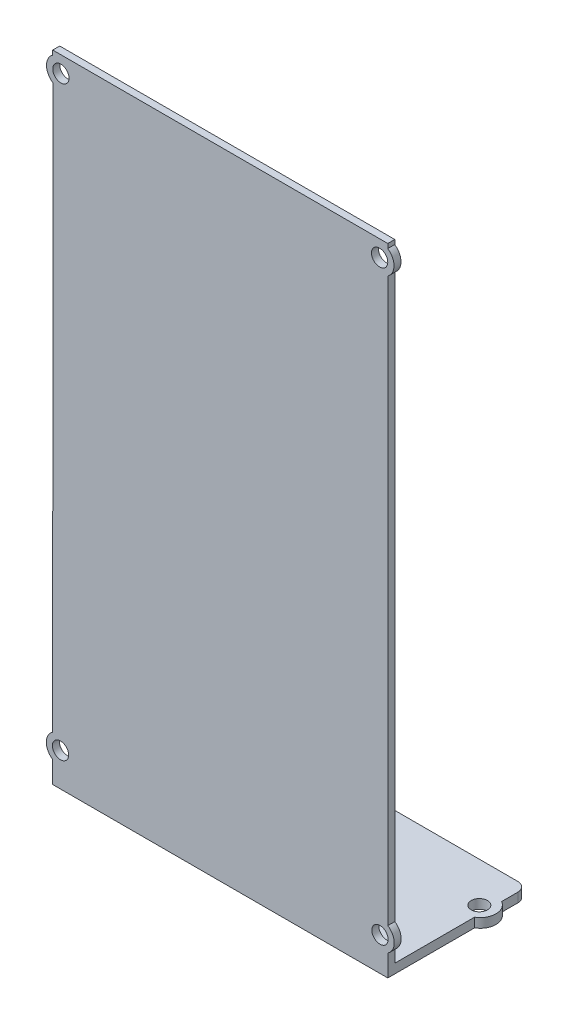
from build123d import *

# Parameters (mm, degrees)
SKETCH1_R                = 1.75
BOSS_EXTRUDE1_DEPTH      = 1.5
BOSS_EXTRUDE2_DEPTH      = 72
BOSS_EXTRUDE3_DEPTH      = 1.5
BOSS_EXTRUDE3_DEPTH_BACK = 1.5
BOSS_EXTRUDE4_DEPTH      = 2
SKETCH5_R                = 1.75
CUT_EXTRUDE1_DEPTH       = 2
CUT_EXTRUDE2_DEPTH       = 148.332054879
CUT_EXTRUDE2_DEPTH_BACK  = 148.332054879
SKETCH6_W                = 72
SKETCH6_H                = 11.553195909
FILLET1_R                = 2
SKETCH8_W                = 35
SKETCH8_H                = 19.946804091
CUT_EXTRUDE3_DEPTH       = 22.4262221


with BuildPart() as part:
    # Sketch1 → Boss-Extrude1 (new body)
    with BuildSketch(Plane.XY):
        with BuildLine():
            Line((-31.5, -134.5), (31.5, -134.5))
            Line((31.5, -134.5), (36, -134.5))
            Line((36, -134.5), (36, -132.049019419))
            ThreePointArc((36, -132.049019419), (37.374296294, -129.5), (36, -126.950980581))
            Line((36, -126.950980581), (36, -6.049019419))
            ThreePointArc((36, -6.049019419), (37.33874188, -3.5), (36, -0.950980581))
            Line((36, -0.950980581), (36, 0))
            Line((36, 0), (-36, 0))
            Line((-36, 0), (-36, -0.950980581))
            ThreePointArc((-36, -0.950980581), (-37.339851511, -3.504206195), (-35.994020506, -6.054285021))
            Line((-35.994020506, -6.054285021), (-36, -126.950980581))
            ThreePointArc((-36, -126.950980581), (-37.376731289, -129.5), (-36, -132.049019419))
            Line((-36, -132.049019419), (-36, -134.5))
            Line((-36, -134.5), (-31.5, -134.5))
        make_face()
        with Locations((-34.328609587, -129.5)):
            Circle(SKETCH1_R, mode=Mode.SUBTRACT)
        with Locations((34.323211043, -129.5)):
            Circle(SKETCH1_R, mode=Mode.SUBTRACT)
        with Locations((34.242652207, -3.5)):
            Circle(SKETCH1_R, mode=Mode.SUBTRACT)
        with Locations((-34.244120111, -3.500578956)):
            Circle(SKETCH1_R, mode=Mode.SUBTRACT)
    extrude(amount=BOSS_EXTRUDE1_DEPTH)

    # Sketch2 → Boss-Extrude2 (add)
    with BuildSketch(Plane.ZY.offset(36)):
        Polygon((1.5, -134.5), (1.5, -136.7), (-40, -136.7), (-40, -134.7), (0, -134.7), (0, -134.5), (0, -132.049019419), (1.5, -132.049019419), align=None)
    extrude(amount=-BOSS_EXTRUDE2_DEPTH)

    # Sketch3 → Boss-Extrude3 (add, two sides: drawn at the far end of the back side and taken through both)
    with BuildSketch(Plane(origin=(0, 0, 0), x_dir=(0, 0, -1), z_dir=(1, 0, 0)).offset(-BOSS_EXTRUDE3_DEPTH_BACK)):
        Polygon((0, -119.7), (15, -134.7), (0, -134.7), align=None)
    extrude(amount=BOSS_EXTRUDE3_DEPTH + BOSS_EXTRUDE3_DEPTH_BACK)

    # Sketch4 → Boss-Extrude4 (add)
    with BuildSketch(Plane.XZ.offset(136.7)):
        with BuildLine():
            Line((-36, -17.152805247), (-36, -22.963011674))
            ThreePointArc((-36, -22.963011674), (-37.650416645, -20.05790846), (-36, -17.152805247))
        make_face()
        with BuildLine():
            Line((36, -17.152805247), (36, -22.963011674))
            ThreePointArc((36, -22.963011674), (37.68082264, -20.05790846), (36, -17.152805247))
        make_face()
    extrude(amount=-BOSS_EXTRUDE4_DEPTH)

    # Sketch5 → Cut-Extrude1 (cut)
    with BuildSketch(Plane.XZ.offset(136.7)):
        with Locations(Location((-34.253947115, -19.946804091, 0), (0, 0, 270))):
            Circle(SKETCH5_R)
        with Locations(Location((34.288977705, -19.889159472, 0), (0, 0, 270))):
            Circle(SKETCH5_R)
    extrude(amount=-CUT_EXTRUDE1_DEPTH, mode=Mode.SUBTRACT)

    # Sketch6 → Cut-Extrude2 (cut, two sides: drawn at the far end of the back side and taken through both)
    with BuildSketch(Plane.XZ.offset(136.7).offset(-CUT_EXTRUDE2_DEPTH_BACK)):
        with Locations((0, -34.223402046)):
            Rectangle(SKETCH6_W, SKETCH6_H)
    extrude(amount=CUT_EXTRUDE2_DEPTH + CUT_EXTRUDE2_DEPTH_BACK, mode=Mode.SUBTRACT)

    # Fillet1
    fillet1_edges = [part.edges().sort_by_distance(p)[0] for p in [
        (36, -135.7, -28.446804091),
        (-36, -135.7, -28.446804091),
    ]]
    fillet(fillet1_edges, radius=FILLET1_R)

    # Sketch8 → Cut-Extrude3 (cut)
    with BuildSketch(Plane.XZ.offset(136.7)):
        with Locations((-13.5, -15.473402046)):
            Rectangle(SKETCH8_W, SKETCH8_H)
    extrude(amount=-CUT_EXTRUDE3_DEPTH, mode=Mode.SUBTRACT)


solid = part.part
